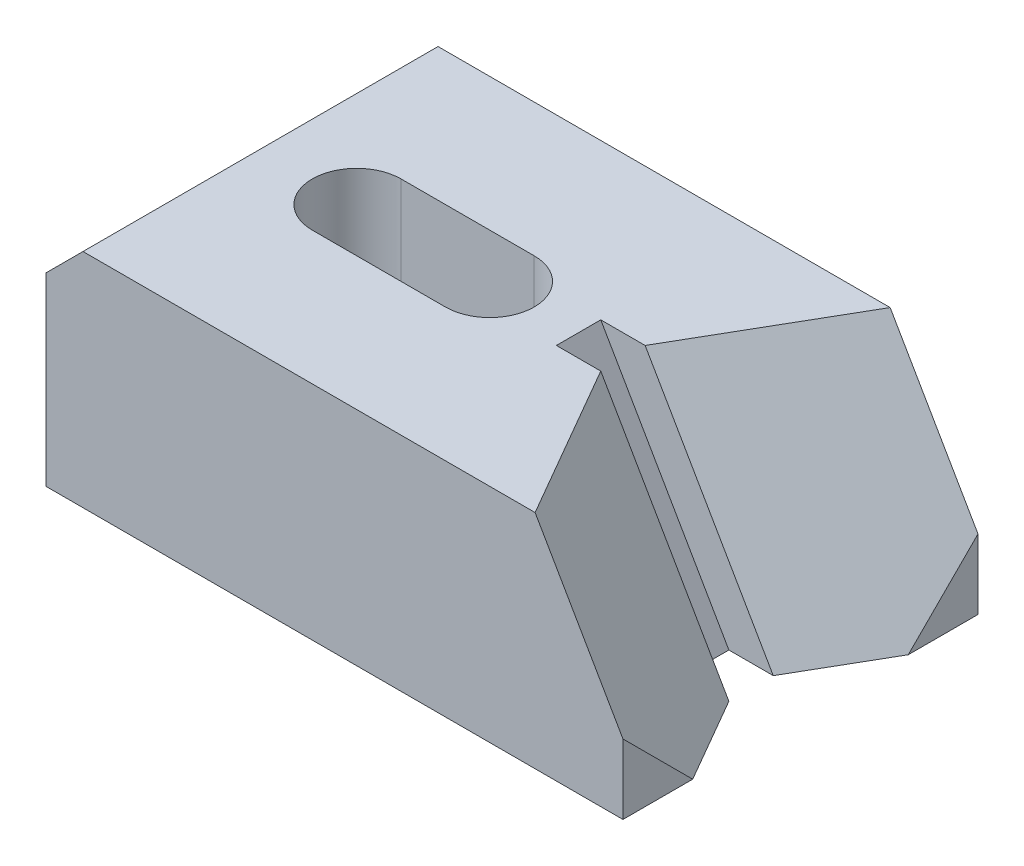
from build123d import *

# Parameters (mm, degrees)
SKETCH1_W           = 78
SKETCH1_H           = 48
BOSS_EXTRUDE1_DEPTH = 30
CHAMFER1_SIZE       = 5
CUT_EXTRUDE1_DEPTH  = 87.948260477
CUT_EXTRUDE2_DEPTH  = 101.553903722


with BuildPart() as part:
    # Sketch1 → Boss-Extrude1 (new body)
    with BuildSketch(Plane(origin=(0, 0, 0), x_dir=(1, 0, 0), z_dir=(0, 1, 0))):
        with Locations((39, 0)):
            Rectangle(SKETCH1_W, SKETCH1_H)
    extrude(amount=BOSS_EXTRUDE1_DEPTH)

    # Chamfer1
    chamfer1_edges = [part.edges().sort_by_distance(p)[0] for p in [
        (0, 30, 0),
    ]]
    chamfer(chamfer1_edges, length=CHAMFER1_SIZE)

    # Sketch2 → Cut-Extrude1 (cut, through all)
    with BuildSketch(Plane(origin=(0, 30, 0), x_dir=(1, 0, 0), z_dir=(0, 1, 0))):
        with BuildLine():
            Line((18, 6), (36, 6))
            ThreePointArc((36, 6), (42, 0), (36, -6))
            Line((36, -6), (18, -6))
            ThreePointArc((18, -6), (12, 0), (18, 6))
        make_face()
    extrude(amount=-CUT_EXTRUDE1_DEPTH, mode=Mode.SUBTRACT)

    # Sketch3 → Cut-Extrude2 (cut, through all, along a direction that is not the sketch's normal)
    with BuildSketch(Plane(origin=(0, 30, 0), x_dir=(1, 0, 0), z_dir=(0, 1, 0))):
        Polygon((78, 24), (66.124355653, 24), (54, 3), (48, 3), (48, -3), (54, -3), (66.124355653, -24), (78, -24), align=None)
    extrude(amount=-CUT_EXTRUDE2_DEPTH, dir=(-0.5000000000000044, 0.8660254037844362, 0), mode=Mode.SUBTRACT)


solid = part.part
